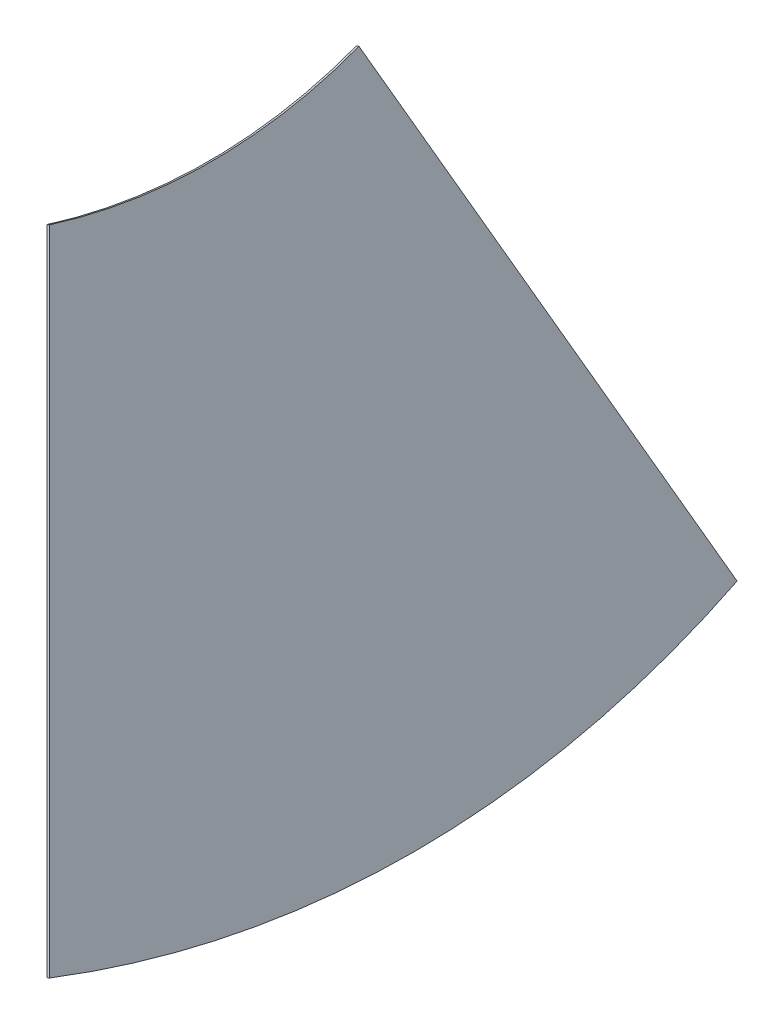
from build123d import *

# Parameters (mm, degrees)
BOSS_EXTRUDE1_DEPTH = 0.635


with BuildPart() as part:
    # Sketch2 → Boss-Extrude1 (new, symmetric)
    with BuildSketch(Plane(origin=(27.417986621, 53.220541518, 84.504712269), x_dir=(-0.26797118733009057, 0.6563926747264984, 0.7052234392916155), z_dir=(-0.9258200997725546, -0.37796447300921987, -1.5945744696156478e-15))):
        with BuildLine():
            Line((-183.012823429, 30.960278722), (-392.894491387, -63.112488088))
            ThreePointArc((-392.894491387, -63.112488088), (-305.706152548, -184.893065182), (-184.391123321, -272.728018763))
            Line((-184.391123321, -272.728018763), (-89.203158884, -63.349769114))
            ThreePointArc((-89.203158884, -63.349769114), (-142.208209655, -22.262597606), (-183.012823429, 30.960278722))
        make_face()
    extrude(amount=BOSS_EXTRUDE1_DEPTH, both=True)


solid = part.part
